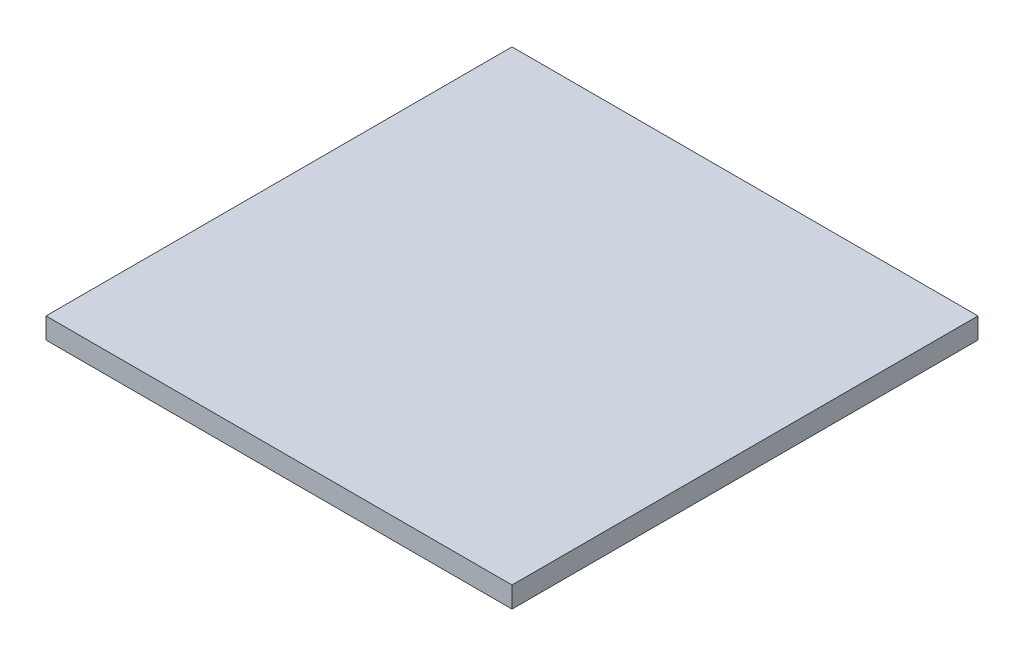
from build123d import *

# Parameters (mm, degrees)
SKETCH1_W           = 49
SKETCH1_H           = 49
BOSS_EXTRUDE1_DEPTH = 1.1


with BuildPart() as part:
    # Sketch1 → Boss-Extrude1 (new, symmetric)
    with BuildSketch(Plane(origin=(0, 0, 0), x_dir=(1, 0, 0), z_dir=(0, 1, 0))):
        Rectangle(SKETCH1_W, SKETCH1_H)
    extrude(amount=BOSS_EXTRUDE1_DEPTH, both=True)


solid = part.part
